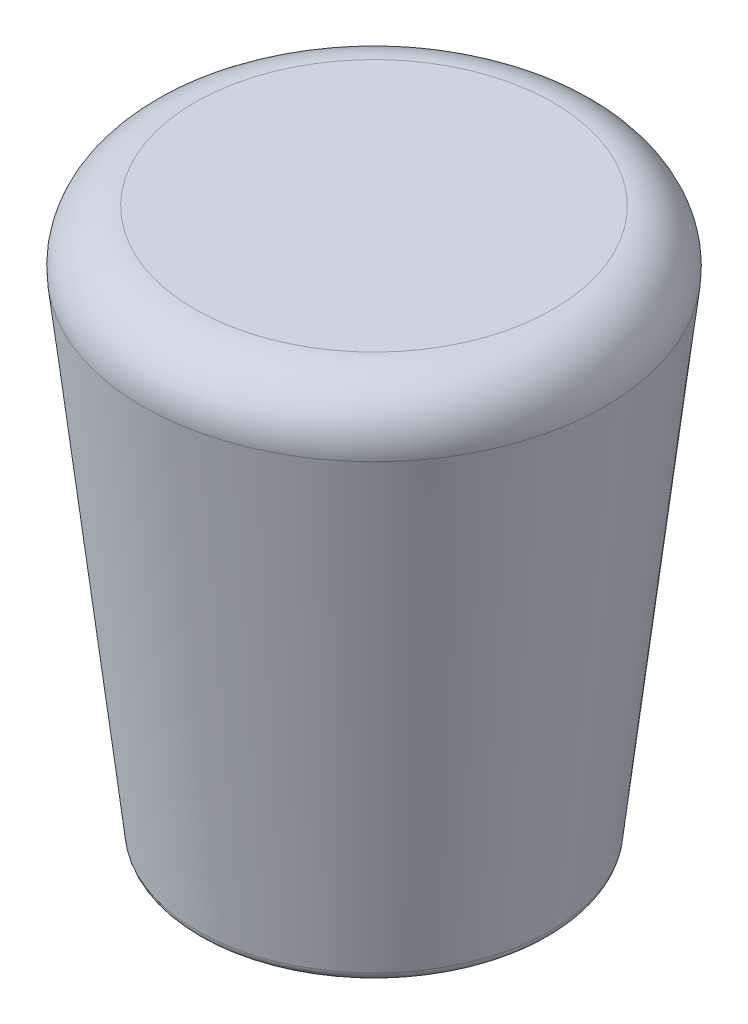
from build123d import *

# Parameters (mm, degrees)
SKETCH_1_R          = 3.35
EXTRUDE_1_DEPTH     = 10.5
EXTRUDE_1_DRAFT     = -6.5
SKETCH_2_R          = 3
CUT_EXTRUDE_1_DEPTH = 9
FILLET_1_R          = 1
FILLET_2_R          = 0.2


with BuildPart() as part:
    # Эскиз1 → Бобышка-Вытянуть1 (with draft: the straight prism first)
    with BuildSketch(Plane(origin=(0, 0, 0), x_dir=(1, 0, 0), z_dir=(0, 1, 0))):
        Circle(SKETCH_1_R)
    extrude(amount=EXTRUDE_1_DEPTH)
    # Бобышка-Вытянуть1: the draft: its side faces are tilted about the plane it starts from
    extrude_1_sides = [part.faces().sort_by_distance(p)[0] for p in [
        (-3.35, 5.25, 0),
    ]]
    draft(extrude_1_sides, Plane(origin=(0, 0, 0), x_dir=(1, 0, 0), z_dir=(0, 1, 0)), EXTRUDE_1_DRAFT)

    # Эскиз2 → Вырез-Вытянуть1 (cut)
    with BuildSketch(Plane.XZ):
        with Locations(Location((0, 0, 0), (0, 0, 270))):
            Circle(SKETCH_2_R)
    extrude(amount=-CUT_EXTRUDE_1_DEPTH, mode=Mode.SUBTRACT)

    # Скругление1
    fillet_1_edges = [part.edges().sort_by_distance(p)[0] for p in [
        (-4.546323887, 10.5, 0),
    ]]
    fillet(fillet_1_edges, radius=FILLET_1_R)

    # Скругление2
    fillet_2_edges = [part.edges().sort_by_distance(p)[0] for p in [
        (-3.35, 0, 0),
    ]]
    fillet(fillet_2_edges, radius=FILLET_2_R)


solid = part.part
